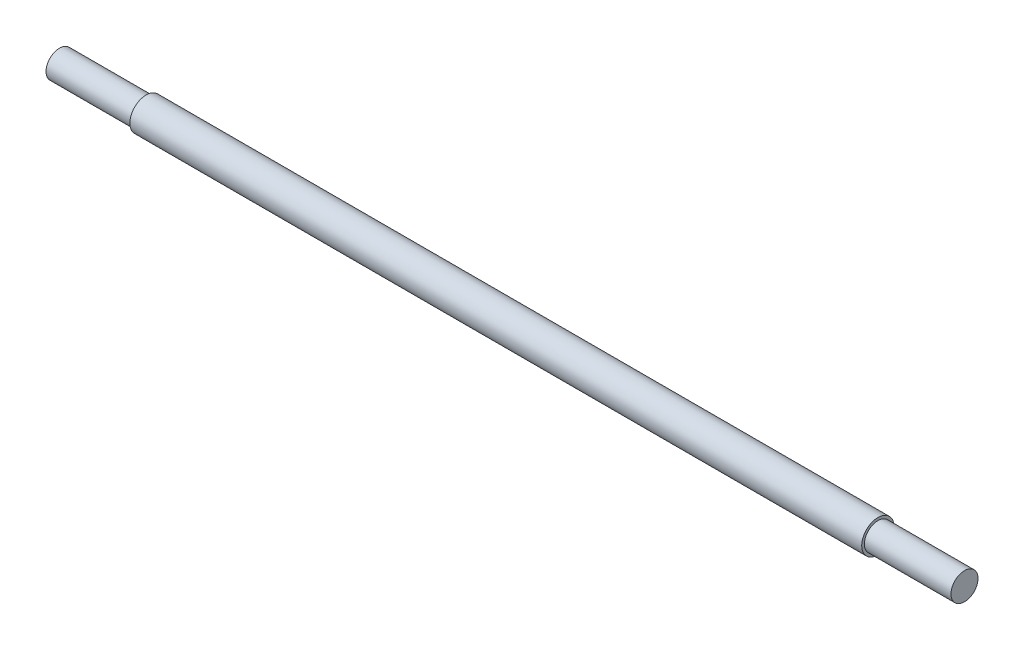
from build123d import *


with BuildPart() as part:
    # Sketch1 → Revolve1 (revolve)
    with BuildSketch(Plane.XY, mode=Mode.PRIVATE) as revolve1_sk:
        Polygon((0, 0), (83.63, 0), (83.63, 1.25), (75.63, 1.25), (75.63, 1.5), (8, 1.5), (8, 1.25), (0, 1.25), align=None)
    revolve(revolve1_sk.sketch.rotate(Axis((0, 0, 0), (1, 0, 0)), 90), axis=Axis((0, 0, 0), (1, 0, 0)))


solid = part.part
